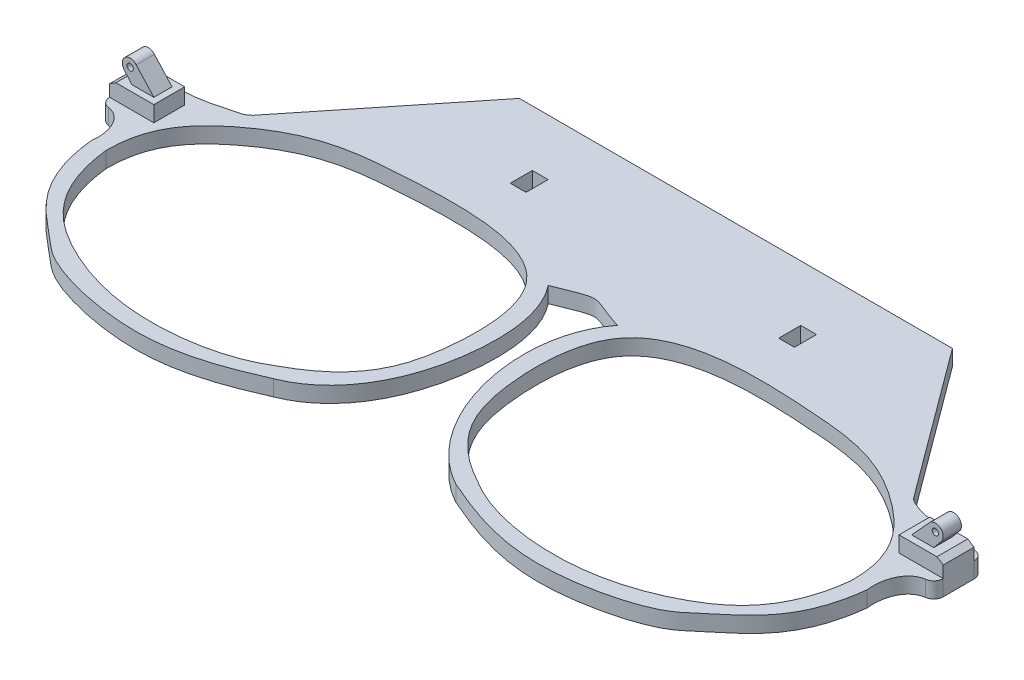
from build123d import *

# Parameters (mm, degrees)
BOSS_EXTRUDE2_DEPTH = 5
BOSS_EXTRUDE3_DEPTH = 7
SKETCH2_4_W         = 5.772435779
SKETCH2_4_H         = 7
BOSS_EXTRUDE4_DEPTH = 5
SKETCH3_R           = 1
CUT_EXTRUDE1_DEPTH  = 208.065878594
SKETCH6_W           = 5
SKETCH6_H           = 7
CUT_EXTRUDE2_DEPTH  = 213.251462741


with BuildPart() as part:
    # Sketch1 → Boss-Extrude2 (new body)
    # profile 1 of 4: a face of its own
    with BuildSketch(Plane(origin=(0, 0, 0), x_dir=(1, 0, 0), z_dir=(0, 1, 0))):
        with BuildLine():
            Line((68, 15.074365775), (68, 24.846801554))
            ThreePointArc((68, 24.846801554), (67.268774739, 26.809621256), (65.431559211, 27.815598726))
            add(Edge.make_bspline(
                [(42.497006951, 31.473771916), (45.841535206, 29.768669785), (53.798896899, 28.492908489), (62.072418833, 28.303900178), (65.431559211, 27.815598726)],
                knots=[0.054561996, 0.054561996, 0.054561996, 0.054561996, 0.473956485, 0.880923623, 0.880923623, 0.880923623, 0.880923623], degree=3))
            ThreePointArc((42.497006951, 31.473771916), (41.728883026, 31.984800317), (41.098270813, 32.658218928))
            Line((41.098270813, 32.658218928), (6.321974116, 79.659797769))
            Line((6.321974116, 79.659797769), (-130.823712763, 79.659797769))
            Line((-130.823712763, 79.659797769), (-168.357434382, 32.849331616))
            ThreePointArc((-168.357434382, 32.849331616), (-168.373978152, 32.828837542), (-168.390656508, 32.808452847))
            ThreePointArc((-168.390656508, 32.808452847), (-169.081796989, 32.148834352), (-169.909644155, 31.67192682))
            add(Edge.make_bspline(
                [(-186.889702979, 2.818515292), (-185.958801053, 13.813191283), (-178.704046411, 24.611644239), (-170.582497362, 31.153016341), (-169.909644155, 31.67192682)],
                knots=[0.01074649, 0.01074649, 0.01074649, 0.01074649, 0.137496661, 0.148923781, 0.148923781, 0.148923781, 0.148923781], degree=3))
            add(Edge.make_bspline(
                [(-187, 0), (-186.877122184, 0.850170327), (-186.834034486, 1.814128347), (-186.889702979, 2.818515292)],
                knots=[0, 0, 0, 0, 0.184082454, 0.184082454, 0.184082454, 0.184082454], degree=3))
            add(Edge.make_bspline(
                [(-92.881574513, -36.160073701), (-103.617442681, -40.871542321), (-124.35902934, -48.786263046), (-158.61212291, -40.484551569), (-172.410552718, -27.76178335), (-184.714807633, -20.619880927), (-187, 0)],
                knots=[0, 0, 0, 0, 0.267825908, 0.508869226, 0.582086635, 1, 1, 1, 1], degree=3))
            add(Edge.make_bspline(
                [(-74.947788511, 32.929092359), (-69.03030208, 25.480038353), (-65.274431542, -1.524862565), (-77.383264734, -29.954640995), (-92.881574513, -36.160073701)],
                knots=[0.639271593, 0.639271593, 0.639271593, 0.639271593, 0.783382198, 1, 1, 1, 1], degree=3))
            add(Edge.make_bspline(
                [(-74.947788511, 32.929092359), (-60.911730061, 38.500342452), (-66.168070855, 37.168029476), (-53.052211489, 32.929092359)],
                knots=[0, 0, 0, 0, 1, 1, 1, 1], degree=3))
            add(Edge.make_bspline(
                [(-53.052211489, 32.929092359), (-67.279339394, 15.019679466), (-58.596650193, -23.548887855), (-35.118425487, -36.160073701)],
                knots=[0.639271593, 0.639271593, 0.639271593, 0.639271593, 1, 1, 1, 1], degree=3))
            add(Edge.make_bspline(
                [(-35.118425487, -36.160073701), (-24.382557319, -40.871542321), (-3.64097066, -48.786263046), (30.61212291, -40.484551569), (44.410552718, -27.76178335), (56.714807633, -20.619880927), (59, 0)],
                knots=[0, 0, 0, 0, 0.267825908, 0.508869226, 0.582086635, 1, 1, 1, 1], degree=3))
            add(Edge.make_bspline(
                [(59, 0), (58.388482892, 4.230980962), (59.753113299, 11.280121294), (65.431559211, 12.105568604)],
                knots=[0, 0, 0, 0, 0.916109789, 0.916109789, 0.916109789, 0.916109789], degree=3))
            ThreePointArc((65.431559211, 12.105568604), (67.268774739, 13.111546073), (68, 15.074365775))
        make_face()
        with BuildLine():
            add(Edge.make_bspline(
                [(-95.857712266, -32.142287734), (-104.471539105, -37.565808336), (-128.714227319, -42.556524389), (-160.976837774, -34.658421894), (-179.899166505, -18.956363211), (-182, 0)],
                knots=[0, 0, 0, 0, 0.331432867, 0.662865733, 1, 1, 1, 1], degree=3))
            add(Edge.make_bspline(
                [(-182, 0), (-182.08200901, 12.107781209), (-175.753339721, 21.324758613), (-153.042034044, 37.943033501), (-127.150989048, 40.566242244), (-74.310738013, 42.327876231), (-72.13772655, -3.841036124), (-79.328025139, -23.238914829), (-95.857712266, -32.142287734)],
                knots=[0, 0, 0, 0, 0.137496661, 0.174732423, 0.372357619, 0.639271593, 0.803593963, 1, 1, 1, 1], degree=3))
        make_face(mode=Mode.SUBTRACT)
        with BuildLine():
            add(Edge.make_bspline(
                [(54, 0), (54.08200901, 12.107781209), (47.753339721, 21.324758613), (25.042034044, 37.943033501), (-0.849010952, 40.566242244), (-53.689261987, 42.327876231), (-55.86227345, -3.841036124), (-48.671974861, -23.238914829), (-32.142287734, -32.142287734)],
                knots=[0, 0, 0, 0, 0.137496661, 0.174732423, 0.372357619, 0.639271593, 0.803593963, 1, 1, 1, 1], degree=3))
            add(Edge.make_bspline(
                [(-32.142287734, -32.142287734), (-23.528460895, -37.565808336), (0.714227319, -42.556524389), (32.976837774, -34.658421894), (51.899166505, -18.956363211), (54, 0)],
                knots=[0, 0, 0, 0, 0.331432867, 0.662865733, 1, 1, 1, 1], degree=3))
        make_face(mode=Mode.SUBTRACT)
    # profile 2 of 4: a face of its own
    with BuildSketch(Plane(origin=(0, 0, 0), x_dir=(1, 0, 0), z_dir=(0, 1, 0))):
        with BuildLine():
            ThreePointArc((-169.909644155, 31.67192682), (-169.081796989, 32.148834352), (-168.390656508, 32.808452847))
            add(Edge.make_bspline(
                [(-169.217617173, 32.197955257), (-168.941807846, 32.404812498), (-168.666165652, 32.608292359), (-168.390656508, 32.808452847)],
                knots=[0.152774068, 0.152774068, 0.152774068, 0.152774068, 0.157456216, 0.157456216, 0.157456216, 0.157456216], degree=3))
            add(Edge.make_bspline(
                [(-169.909644155, 31.67192682), (-169.682542652, 31.847069554), (-169.451805831, 32.022356896), (-169.221114016, 32.195333782), (-169.217617173, 32.197955257)],
                knots=[0.148923781, 0.148923781, 0.148923781, 0.148923781, 0.152780664, 0.152840027, 0.152840027, 0.152840027, 0.152840027], degree=3))
        make_face()
    # profile 3 of 4: a face of its own
    with BuildSketch(Plane(origin=(0, 0, 0), x_dir=(1, 0, 0), z_dir=(0, 1, 0))):
        with BuildLine():
            add(Edge.make_bspline(
                [(-187, 0), (-187.006409675, 0.946322211), (-186.968629324, 1.886333747), (-186.889702979, 2.818515292)],
                knots=[0, 0, 0, 0, 0.01074649, 0.01074649, 0.01074649, 0.01074649], degree=3))
            add(Edge.make_bspline(
                [(-187, 0), (-186.877122184, 0.850170327), (-186.834034486, 1.814128347), (-186.889702979, 2.818515292)],
                knots=[0, 0, 0, 0, 0.184082454, 0.184082454, 0.184082454, 0.184082454], degree=3))
        make_face()
    # profile 4 of 4: a face of its own
    with BuildSketch(Plane(origin=(0, 0, 0), x_dir=(1, 0, 0), z_dir=(0, 1, 0))):
        with BuildLine():
            add(Edge.make_bspline(
                [(-186.889702979, 2.818515292), (-185.958801053, 13.813191283), (-178.704046411, 24.611644239), (-170.582497362, 31.153016341), (-169.909644155, 31.67192682)],
                knots=[0.01074649, 0.01074649, 0.01074649, 0.01074649, 0.137496661, 0.148923781, 0.148923781, 0.148923781, 0.148923781], degree=3))
            ThreePointArc((-169.909644155, 31.67192682), (-170.19948122, 31.56145415), (-170.497006951, 31.473771916))
            add(Edge.make_bspline(
                [(-170.497006951, 31.473771916), (-174.136423388, 30.552962205), (-181.65582182, 28.112382218), (-190.072418833, 28.303900178), (-193.431559211, 27.815598726)],
                knots=[0.054561996, 0.054561996, 0.054561996, 0.054561996, 0.473956485, 0.880923623, 0.880923623, 0.880923623, 0.880923623], degree=3))
            ThreePointArc((-193.431559211, 27.815598726), (-195.268774739, 26.809621256), (-196, 24.846801554))
            Line((-196, 24.846801554), (-196, 15.074365775))
            ThreePointArc((-196, 15.074365775), (-195.268774739, 13.111546073), (-193.431559211, 12.105568604))
            add(Edge.make_bspline(
                [(-186.889702979, 2.818515292), (-187.111075835, 6.812587961), (-188.894136211, 11.445986093), (-193.431559211, 12.105568604)],
                knots=[0.184082454, 0.184082454, 0.184082454, 0.184082454, 0.916109789, 0.916109789, 0.916109789, 0.916109789], degree=3))
        make_face()
    extrude(amount=BOSS_EXTRUDE2_DEPTH)

    # Sketch2 → Boss-Extrude3 (add, symmetric)
    with BuildSketch(Plane(origin=(61, 0, 0), x_dir=(0, 0, -1), z_dir=(1, 0, 0))):
        Polygon((15.074365775, 10), (15.074365775, 5), (24.846801554, 5), (24.846801554, 10), (22.846801554, 10), (17.074365775, 10), align=None)
    boss_extrude3 = extrude(amount=BOSS_EXTRUDE3_DEPTH, both=True)

    # Sketch2<4> → Boss-Extrude4 (add, symmetric)
    with BuildSketch(Plane(origin=(61, 0, 0), x_dir=(0, 0, -1), z_dir=(1, 0, 0))):
        with Locations((19.960583664, 13.5)):
            Rectangle(SKETCH2_4_W, SKETCH2_4_H)
    boss_extrude4 = extrude(amount=BOSS_EXTRUDE4_DEPTH, both=True)

    # Sketch3 → Cut-Extrude1 (cut, through all)
    with BuildSketch(Plane.XY.offset(-15.074365775)):
        Polygon((68, 10), (66, 10), (68, 8.730812567), align=None)
        with BuildLine():
            Line((56, 17), (56, 10))
            Line((56, 10), (61.581791004, 16.103269862))
            ThreePointArc((61.581791004, 16.103269862), (61.655177652, 16.187196048), (61.732233047, 16.267766953))
            ThreePointArc((61.732233047, 16.267766953), (62.543291419, 16.809698831), (63.5, 17))
            Line((63.5, 17), (56, 17))
        make_face()
        with BuildLine():
            ThreePointArc((63.5, 17), (65.267766953, 16.267766953), (66, 14.5))
            Line((66, 14.5), (66, 17))
            Line((66, 17), (63.5, 17))
        make_face()
        with BuildLine():
            Line((63, 10), (66, 10))
            Line((66, 10), (66, 14.5))
            ThreePointArc((66, 14.5), (65.809698831, 13.543291419), (65.267766953, 12.732233047))
            Line((65.267766953, 12.732233047), (63, 10))
        make_face()
        with Locations((63.5, 14.5)):
            Circle(SKETCH3_R)
    cut_extrude1 = extrude(amount=-CUT_EXTRUDE1_DEPTH, mode=Mode.SUBTRACT)

    # Mirror1: Boss-Extrude3, Boss-Extrude4, Cut-Extrude1 across plane
    add(boss_extrude3.mirror(Plane(origin=(-64, 0, 0), x_dir=(0, 0, 1), z_dir=(1, 0, 0))))
    add(boss_extrude4.mirror(Plane(origin=(-64, 0, 0), x_dir=(0, 0, 1), z_dir=(1, 0, 0))))
    add(cut_extrude1.mirror(Plane(origin=(-64, 0, 0), x_dir=(0, 0, 1), z_dir=(1, 0, 0))), mode=Mode.SUBTRACT)

    # Sketch6 → Cut-Extrude2 (cut, through all)
    with BuildSketch(Plane.XZ):
        with Locations((-106.5, -58.449797769)):
            Rectangle(SKETCH6_W, SKETCH6_H)
        with Locations((-21.5, -58.449797769)):
            Rectangle(SKETCH6_W, SKETCH6_H)
    extrude(amount=-CUT_EXTRUDE2_DEPTH, mode=Mode.SUBTRACT)


solid = part.part
